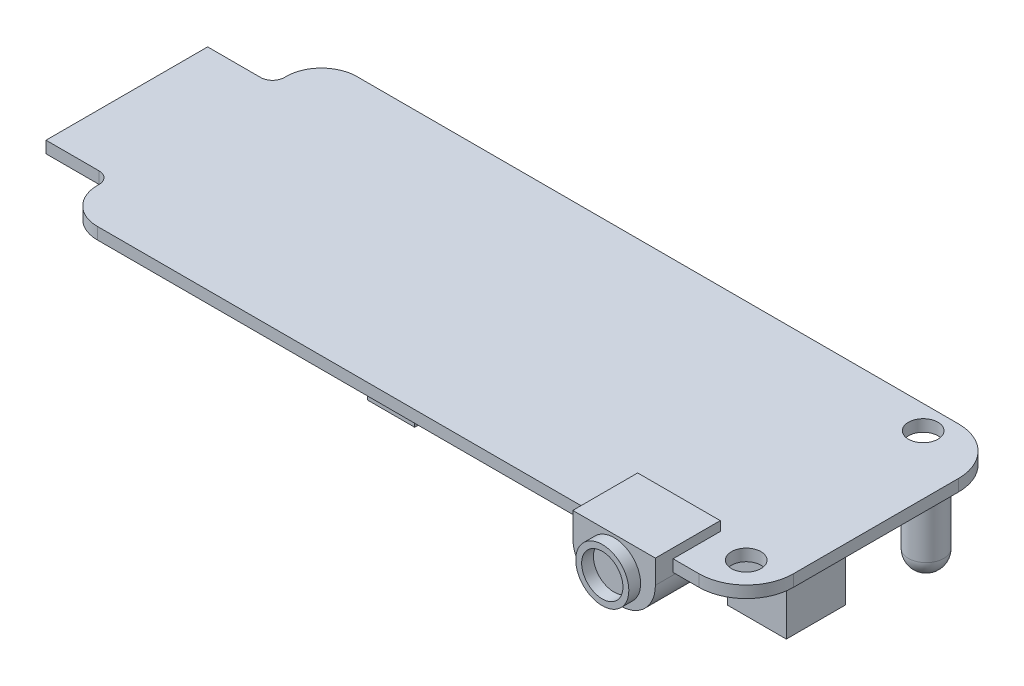
from build123d import *

# Parameters (mm, degrees)
SKETCH_1_R          = 1.25
EXTRUDE_1_DEPTH     = 1
SKETCH_2_R          = 1.5
EXTRUDE_2_DEPTH     = 6.5
FILLET_1_R          = 1.5
SKETCH_3_R          = 3.25
EXTRUDE_3_DEPTH     = 6
FILLET_2_R          = 0.5
SKETCH_4_W          = 5
SKETCH_4_H          = 5
EXTRUDE_4_DEPTH     = 5.2
SKETCH_5_W          = 4
SKETCH_5_H          = 4
SKETCH_5_W_2        = 5.5
SKETCH_5_H_2        = 5.5
SKETCH_5_W_3        = 5
SKETCH_5_H_3        = 3.3
EXTRUDE_5_DEPTH     = 1
SKETCH_6_W          = 3.5
SKETCH_6_H          = 2.8
EXTRUDE_6_DEPTH     = 2.2
FILLET_3_R          = 1
EXTRUDE_START       = -1.8
SKETCH_7_W          = 7
SKETCH_7_H          = 6.5
EXTRUDE_7_DEPTH     = 5
FILLET_4_R          = 3
SKETCH_8_R          = 2.25
SKETCH_8_R_2        = 1.75
CUT_EXTRUDE_1_DEPTH = 1
SKETCH_9_W          = 3.5
SKETCH_9_H          = 6
SKETCH_9_W_2        = 4
SKETCH_9_H_2        = 5.1
EXTRUDE_8_DEPTH     = 1.5


with BuildPart() as part:
    # Эскиз1 → Бобышка-Вытянуть1 (new body)
    with BuildSketch(Plane(origin=(0, 0, 0), x_dir=(1, 0, 0), z_dir=(0, 1, 0))):
        with BuildLine():
            Line((3, 0), (54, 0))
            ThreePointArc((54, 0), (56.828427125, 1.171572875), (58, 4))
            Line((58, 4), (58, 18))
            ThreePointArc((58, 18), (56.828427125, 20.828427125), (54, 22))
            Line((54, 22), (3, 22))
            ThreePointArc((3, 22), (0.878679656, 21.121320344), (0, 19))
            Line((0, 19), (0, 18.85))
            ThreePointArc((0, 18.85), (-0.292893219, 18.142893219), (-1, 17.85))
            Line((-1, 17.85), (-5.5, 17.85))
            Line((-5.5, 17.85), (-5.5, 4.15))
            Line((-5.5, 4.15), (-1, 4.15))
            ThreePointArc((-1, 4.15), (-0.292893219, 3.857106781), (0, 3.15))
            Line((0, 3.15), (0, 3))
            ThreePointArc((0, 3), (0.878679656, 0.878679656), (3, 0))
        make_face()
        with Locations(Location((53, 20, 0), (0, 0, 270))):
            Circle(SKETCH_1_R, mode=Mode.SUBTRACT)
        with Locations(Location((55, 3, 0), (0, 0, 270))):
            Circle(SKETCH_1_R, mode=Mode.SUBTRACT)
    extrude(amount=EXTRUDE_1_DEPTH)

    # Эскиз2 → Бобышка-Вытянуть2 (add)
    with BuildSketch(Plane.XZ):
        with Locations(Location((55.75, -17.5, 0), (0, 0, 90))):
            Circle(SKETCH_2_R)
    extrude(amount=EXTRUDE_2_DEPTH)

    # Скругление1
    fillet_1_edges = [part.edges().sort_by_distance(p)[0] for p in [
        (55.75, -6.5, -19),
    ]]
    fillet(fillet_1_edges, radius=FILLET_1_R)

    # Эскиз3 → Бобышка-Вытянуть3 (add)
    with BuildSketch(Plane.XZ):
        with Locations(Location((7.5, -12, 0), (0, 0, 90))):
            Circle(SKETCH_3_R)
        with Locations(Location((26, -16.5, 0), (0, 0, 90))):
            Circle(SKETCH_3_R)
    extrude(amount=EXTRUDE_3_DEPTH)

    # Скругление2
    fillet_2_edges = [part.edges().sort_by_distance(p)[0] for p in [
        (7.5, -6, -15.25),
        (26, -6, -19.75),
    ]]
    fillet(fillet_2_edges, radius=FILLET_2_R)

    # Эскиз4 → Бобышка-Вытянуть4 (add)
    with BuildSketch(Plane.XZ):
        with Locations((53.8, -7.6)):
            Rectangle(SKETCH_4_W, SKETCH_4_H)
    extrude(amount=EXTRUDE_4_DEPTH)

    # Эскиз5 → Бобышка-Вытянуть5 (add)
    with BuildSketch(Plane.XZ):
        with Locations((40, -12.7)):
            Rectangle(SKETCH_5_W, SKETCH_5_H)
        with Locations((18.25, -11.35)):
            Rectangle(SKETCH_5_W_2, SKETCH_5_H_2)
        with Locations((31.1, -11.85)):
            Rectangle(SKETCH_5_W_3, SKETCH_5_H_3)
    extrude(amount=EXTRUDE_5_DEPTH)

    # Эскиз6 → Бобышка-Вытянуть6 (add)
    with BuildSketch(Plane.XZ):
        with Locations((25.25, -8.2)):
            Rectangle(SKETCH_6_W, SKETCH_6_H)
    extrude(amount=EXTRUDE_6_DEPTH)

    # Скругление3
    fillet_3_edges = [part.edges().sort_by_distance(p)[0] for p in [
        (23.5, -1.1, -6.8),
        (23.5, -1.1, -9.6),
        (27, -1.1, -9.6),
        (27, -1.1, -6.8),
    ]]
    fillet(fillet_3_edges, radius=FILLET_3_R)

    # Эскиз7 → Бобышка-Вытянуть7 (add)
    with BuildSketch(Plane.XZ.offset(EXTRUDE_START)):
        with Locations((48.3, -0.75)):
            Rectangle(SKETCH_7_W, SKETCH_7_H)
    extrude(amount=EXTRUDE_7_DEPTH)

    # Скругление4
    fillet_4_edges = [part.edges().sort_by_distance(p)[0] for p in [
        (44.8, -3.2, -0.75),
        (51.8, -3.2, -0.75),
    ]]
    fillet(fillet_4_edges, radius=FILLET_4_R)

    # Эскиз8 → Вырез-Вытянуть1 (cut)
    # profile 1 of 2: a face of its own
    with BuildSketch(Plane.XY.offset(2.5)):
        with BuildLine():
            ThreePointArc((44.8, -0.2), (45.678679656, -2.321320344), (47.8, -3.2))
            Line((47.8, -3.2), (48.8, -3.2))
            ThreePointArc((48.8, -3.2), (50.921320344, -2.321320344), (51.8, -0.2))
            Line((51.8, -0.2), (51.8, 1.8))
            Line((51.8, 1.8), (44.8, 1.8))
            Line((44.8, 1.8), (44.8, -0.2))
        make_face()
        with Locations((48.3, -0.7)):
            Circle(SKETCH_8_R, mode=Mode.SUBTRACT)
    # profile 2 of 2: a face of its own
    with BuildSketch(Plane.XY.offset(2.5)):
        with Locations((48.3, -0.7)):
            Circle(SKETCH_8_R_2)
    extrude(amount=-CUT_EXTRUDE_1_DEPTH, mode=Mode.SUBTRACT)

    # Эскиз9 → Бобышка-Вытянуть8 (add)
    with BuildSketch(Plane.XZ):
        with Locations((6.25, -4.5)):
            Rectangle(SKETCH_9_W, SKETCH_9_H)
        with Locations((26.7, -3.75)):
            Rectangle(SKETCH_9_W_2, SKETCH_9_H_2)
    extrude(amount=EXTRUDE_8_DEPTH)


solid = part.part
